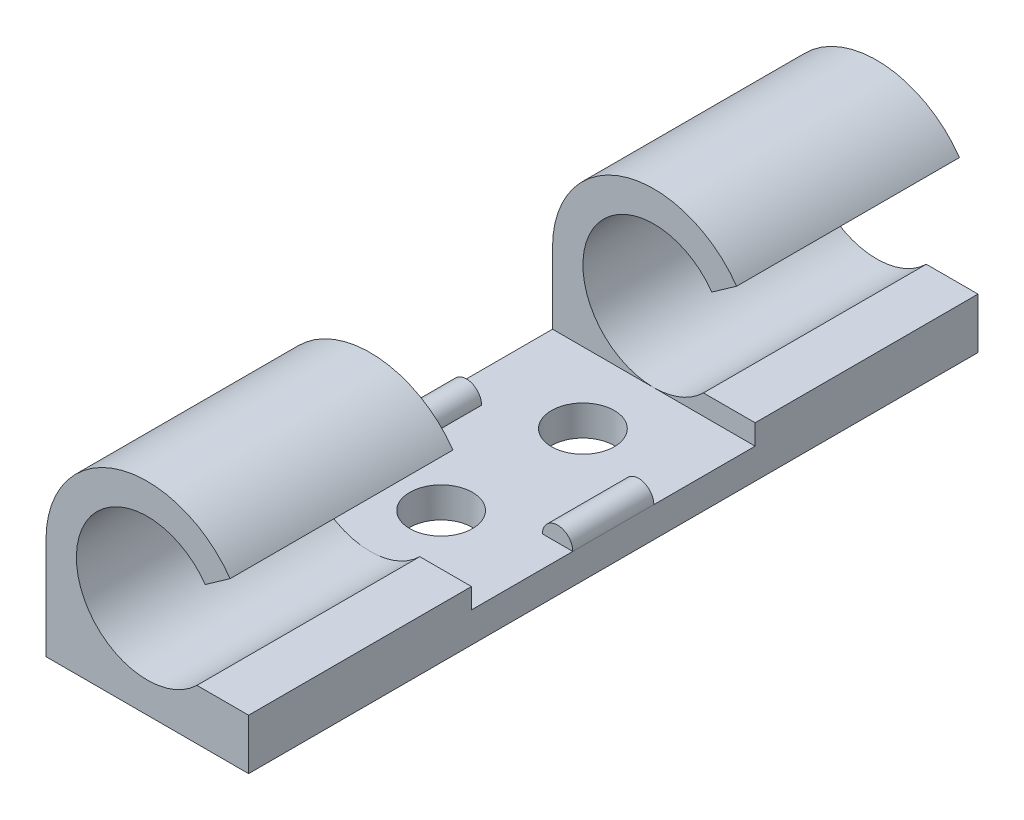
from build123d import *

# Parameters (mm, degrees)
RESSALTO_EXTRUS_O1_DEPTH = 11
ESBO_O2_W                = 10
ESBO_O2_H                = 1.5
RESSALTO_EXTRUS_O2_DEPTH = 7
RESSALTO_EXTRUS_O3_DEPTH = 2
ESBO_O4_R                = 1.55
CORTE_EXTRUS_O1_DEPTH    = 2
CORTE_EXTRUS_O2_DEPTH    = 37.687872656


with BuildPart() as part:
    # Esboço1 → Ressalto-extrusão1 (new body)
    with BuildSketch(Plane.XY):
        with BuildLine():
            Line((-5, -5), (0, -5))
            ThreePointArc((0, -5), (-3.535533906, -3.535533906), (-5, 0))
            Line((-5, 0), (-5, -5))
        make_face()
        with BuildLine():
            Line((5, -5), (5, 0))
            ThreePointArc((5, 0), (3.535533906, -3.535533906), (0, -5))
            Line((0, -5), (5, -5))
        make_face()
        with BuildLine():
            ThreePointArc((-3.5, 0), (0, 3.5), (3.5, 0))
            Line((3.5, 0), (5, 0))
            ThreePointArc((5, 0), (3.535533906, 3.535533905), (1e-09, 5))
            ThreePointArc((1e-09, 5), (-3.535533905, 3.535533906), (-5, 0))
            Line((-5, 0), (-3.5, 0))
        make_face()
        with BuildLine():
            Line((5, 0), (3.5, 0))
            ThreePointArc((3.5, 0), (0, -3.5), (-3.5, 0))
            Line((-3.5, 0), (-5, 0))
            ThreePointArc((-5, 0), (-3.535533906, -3.535533906), (0, -5))
            ThreePointArc((0, -5), (3.535533906, -3.535533906), (5, 0))
        make_face()
    ressalto_extrus_o1 = extrude(amount=RESSALTO_EXTRUS_O1_DEPTH)

    # Esboço2 → Ressalto-extrusão2 (add)
    with BuildSketch(Plane.XY.offset(11)):
        with Locations((0, -4.25)):
            Rectangle(ESBO_O2_W, ESBO_O2_H)
    ressalto_extrus_o2 = extrude(amount=RESSALTO_EXTRUS_O2_DEPTH)

    # Esboço3 → Ressalto-extrusão3 (add)
    with BuildSketch(Plane.XY.offset(18)):
        with BuildLine():
            Line((3.5, -3.5), (5, -3.5))
            ThreePointArc((5, -3.5), (4.25, -2.75), (3.5, -3.5))
        make_face()
        with BuildLine():
            Line((-5, -3.5), (-3.5, -3.5))
            ThreePointArc((-3.5, -3.5), (-4.25, -2.75), (-5, -3.5))
        make_face()
    ressalto_extrus_o3 = extrude(amount=-RESSALTO_EXTRUS_O3_DEPTH)

    # Espelhar1: Ressalto-extrusão1, Ressalto-extrusão2, Ressalto-extrusão3 across plane
    add(ressalto_extrus_o1.mirror(Plane(origin=(0, 0, 18), x_dir=(1, 0, 0), z_dir=(0, 0, -1))))
    add(ressalto_extrus_o2.mirror(Plane(origin=(0, 0, 18), x_dir=(1, 0, 0), z_dir=(0, 0, -1))))
    add(ressalto_extrus_o3.mirror(Plane(origin=(0, 0, 18), x_dir=(1, 0, 0), z_dir=(0, 0, -1))))

    # Esboço4 → Corte-extrusão1 (cut)
    with BuildSketch(Plane(origin=(0, -3.5, 0), x_dir=(1, 0, 0), z_dir=(0, 1, 0))):
        with Locations(Location((0, -14.5, 0), (0, 0, 270))):
            Circle(ESBO_O4_R)
        with Locations(Location((0, -21.5, 0), (0, 0, 270))):
            Circle(ESBO_O4_R)
    extrude(amount=-CORTE_EXTRUS_O1_DEPTH, mode=Mode.SUBTRACT)

    # Esboço5 → Corte-extrusão2 (cut, through all)
    with BuildSketch(Plane.XY.offset(36)):
        with BuildLine():
            Line((2.449489743, -2.5), (5, -2.5))
            Line((5, -2.5), (5, 0))
            ThreePointArc((5, 0), (4.766431527, 1.510341187), (4.087547799, 2.87957514))
            Line((4.087547799, 2.87957514), (2.861283459, 2.015702598))
            ThreePointArc((2.861283459, 2.015702598), (3.336502069, 1.057238831), (3.5, 0))
            ThreePointArc((3.5, 0), (3.226702194, -1.355873501), (2.449489743, -2.5))
        make_face()
    extrude(amount=-CORTE_EXTRUS_O2_DEPTH, mode=Mode.SUBTRACT)


solid = part.part
